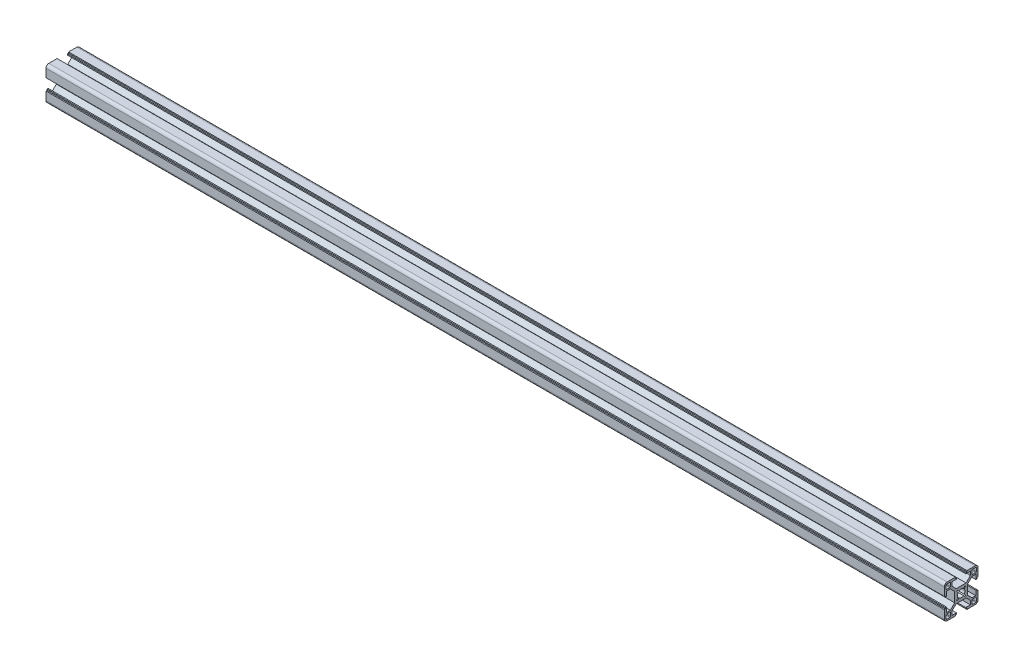
from build123d import *

# Parameters (mm, degrees)
EXTRUDE_1_DEPTH     = 50
EXTRUDE_2_DEPTH     = 800
CUT_EXTRUDE_START   = 15.049571
SKETCH_3_R          = 3
CUT_EXTRUDE_1_DEPTH = 30
CUT_EXTRUDE_START_2 = -14.950429
SKETCH_4_R          = 3
CUT_EXTRUDE_2_DEPTH = 30


with BuildPart() as part:
    # 草图1 → 凸台-拉伸1 (new body)
    with BuildSketch(Plane(origin=(0, 0, 0), x_dir=(0, 0, -1), z_dir=(1, 0, 0))):
        with BuildLine():
            Line((-5.14957074, -13.70467014), (-4.14957074, -13.70467014))
            Line((-4.14957074, -13.70467014), (-4.14957074, -12.70467014))
            Line((-4.14957074, -12.70467014), (-8.29957074, -12.70467014))
            Line((-8.29957074, -12.70467014), (-8.29957074, -9.3688837))
            Line((-8.29957074, -9.3688837), (-4.43535718, -5.50467014))
            Line((-4.43535718, -5.50467014), (4.3362157, -5.50467014))
            Line((4.3362157, -5.50467014), (8.20042926, -9.3688837))
            Line((8.20042926, -9.3688837), (8.20042926, -12.70467014))
            Line((8.20042926, -12.70467014), (4.05042926, -12.70467014))
            Line((4.05042926, -12.70467014), (4.05042926, -13.70467014))
            Line((4.05042926, -13.70467014), (5.05042926, -13.70467014))
            Line((5.05042926, -13.70467014), (5.05042926, -14.70467014))
            Line((5.05042926, -14.70467014), (12.45042926, -14.70467014))
            ThreePointArc((12.45042926, -14.70467014), (14.218196213, -13.972437093), (14.95042926, -12.20467014))
            Line((14.95042926, -12.20467014), (14.95042926, -4.80467014))
            Line((14.95042926, -4.80467014), (13.95042926, -4.80467014))
            Line((13.95042926, -4.80467014), (13.95042926, -3.80467014))
            Line((13.95042926, -3.80467014), (12.95042926, -3.80467014))
            Line((12.95042926, -3.80467014), (12.95042926, -7.95467014))
            Line((12.95042926, -7.95467014), (9.61464282, -7.95467014))
            Line((9.61464282, -7.95467014), (5.75042926, -4.09045658))
            Line((5.75042926, -4.09045658), (5.75042926, 4.6811163))
            Line((5.75042926, 4.6811163), (9.61464282, 8.54532986))
            Line((9.61464282, 8.54532986), (12.95042926, 8.54532986))
            Line((12.95042926, 8.54532986), (12.95042926, 4.39532986))
            Line((12.95042926, 4.39532986), (13.95042926, 4.39532986))
            Line((13.95042926, 4.39532986), (13.95042926, 5.39532986))
            Line((13.95042926, 5.39532986), (14.95042926, 5.39532986))
            Line((14.95042926, 5.39532986), (14.95042926, 12.79532986))
            ThreePointArc((14.95042926, 12.79532986), (14.218196213, 14.563096813), (12.45042926, 15.29532986))
            Line((12.45042926, 15.29532986), (5.05042926, 15.29532986))
            Line((5.05042926, 15.29532986), (5.05042926, 14.29532986))
            Line((5.05042926, 14.29532986), (4.05042926, 14.29532986))
            Line((4.05042926, 14.29532986), (4.05042926, 13.29532986))
            Line((4.05042926, 13.29532986), (8.20042926, 13.29532986))
            Line((8.20042926, 13.29532986), (8.20042926, 9.95954342))
            Line((8.20042926, 9.95954342), (4.3362157, 6.09532986))
            Line((4.3362157, 6.09532986), (-4.43535718, 6.09532986))
            Line((-4.43535718, 6.09532986), (-8.29957074, 9.95954342))
            Line((-8.29957074, 9.95954342), (-8.29957074, 13.29532986))
            Line((-8.29957074, 13.29532986), (-4.14957074, 13.29532986))
            Line((-4.14957074, 13.29532986), (-4.14957074, 14.29532986))
            Line((-4.14957074, 14.29532986), (-5.14957074, 14.29532986))
            Line((-5.14957074, 14.29532986), (-5.14957074, 15.29532986))
            Line((-5.14957074, 15.29532986), (-12.54957074, 15.29532986))
            ThreePointArc((-12.54957074, 15.29532986), (-14.317337693, 14.563096813), (-15.04957074, 12.79532986))
            Line((-15.04957074, 12.79532986), (-15.04957074, 5.39532986))
            Line((-15.04957074, 5.39532986), (-14.04957074, 5.39532986))
            Line((-14.04957074, 5.39532986), (-14.04957074, 4.39532986))
            Line((-14.04957074, 4.39532986), (-13.04957074, 4.39532986))
            Line((-13.04957074, 4.39532986), (-13.04957074, 8.54532986))
            Line((-13.04957074, 8.54532986), (-9.7137843, 8.54532986))
            Line((-9.7137843, 8.54532986), (-5.84957074, 4.6811163))
            Line((-5.84957074, 4.6811163), (-5.84957074, -4.09045658))
            Line((-5.84957074, -4.09045658), (-9.7137843, -7.95467014))
            Line((-9.7137843, -7.95467014), (-13.04957074, -7.95467014))
            Line((-13.04957074, -7.95467014), (-13.04957074, -3.80467014))
            Line((-13.04957074, -3.80467014), (-14.04957074, -3.80467014))
            Line((-14.04957074, -3.80467014), (-14.04957074, -4.80467014))
            Line((-14.04957074, -4.80467014), (-15.04957074, -4.80467014))
            Line((-15.04957074, -4.80467014), (-15.04957074, -12.20467014))
            ThreePointArc((-15.04957074, -12.20467014), (-14.317337693, -13.972437093), (-12.54957074, -14.70467014))
            Line((-12.54957074, -14.70467014), (-5.14957074, -14.70467014))
            Line((-5.14957074, -14.70467014), (-5.14957074, -13.70467014))
        make_face()
        with BuildLine():
            Line((-10.04957074, 9.79532986), (-13.04957074, 9.79532986))
            ThreePointArc((-13.04957074, 9.79532986), (-13.403124131, 9.941776469), (-13.54957074, 10.29532986))
            Line((-13.54957074, 10.29532986), (-13.54957074, 13.29532986))
            ThreePointArc((-13.54957074, 13.29532986), (-13.403124131, 13.648883251), (-13.04957074, 13.79532986))
            Line((-13.04957074, 13.79532986), (-10.04957074, 13.79532986))
            ThreePointArc((-10.04957074, 13.79532986), (-9.696017349, 13.648883251), (-9.54957074, 13.29532986))
            Line((-9.54957074, 13.29532986), (-9.54957074, 10.29532986))
            ThreePointArc((-9.54957074, 10.29532986), (-9.696017349, 9.941776469), (-10.04957074, 9.79532986))
        make_face(mode=Mode.SUBTRACT)
        with BuildLine():
            Line((-10.04957074, -13.20467014), (-13.04957074, -13.20467014))
            ThreePointArc((-13.04957074, -13.20467014), (-13.403124131, -13.058223531), (-13.54957074, -12.70467014))
            Line((-13.54957074, -12.70467014), (-13.54957074, -9.70467014))
            ThreePointArc((-13.54957074, -9.70467014), (-13.403124131, -9.351116749), (-13.04957074, -9.20467014))
            Line((-13.04957074, -9.20467014), (-10.04957074, -9.20467014))
            ThreePointArc((-10.04957074, -9.20467014), (-9.696017349, -9.351116749), (-9.54957074, -9.70467014))
            Line((-9.54957074, -9.70467014), (-9.54957074, -12.70467014))
            ThreePointArc((-9.54957074, -12.70467014), (-9.696017349, -13.058223531), (-10.04957074, -13.20467014))
        make_face(mode=Mode.SUBTRACT)
        with BuildLine():
            Line((12.95042926, 9.79532986), (9.95042926, 9.79532986))
            ThreePointArc((9.95042926, 9.79532986), (9.596875869, 9.941776469), (9.45042926, 10.29532986))
            Line((9.45042926, 10.29532986), (9.45042926, 13.29532986))
            ThreePointArc((9.45042926, 13.29532986), (9.596875869, 13.648883251), (9.95042926, 13.79532986))
            Line((9.95042926, 13.79532986), (12.95042926, 13.79532986))
            ThreePointArc((12.95042926, 13.79532986), (13.303982651, 13.648883251), (13.45042926, 13.29532986))
            Line((13.45042926, 13.29532986), (13.45042926, 10.29532986))
            ThreePointArc((13.45042926, 10.29532986), (13.303982651, 9.941776469), (12.95042926, 9.79532986))
        make_face(mode=Mode.SUBTRACT)
        with BuildLine():
            Line((13.45042926, -9.70467014), (13.45042926, -12.70467014))
            ThreePointArc((13.45042926, -12.70467014), (13.303982651, -13.058223531), (12.95042926, -13.20467014))
            Line((12.95042926, -13.20467014), (9.95042926, -13.20467014))
            ThreePointArc((9.95042926, -13.20467014), (9.596875869, -13.058223531), (9.45042926, -12.70467014))
            Line((9.45042926, -12.70467014), (9.45042926, -9.70467014))
            ThreePointArc((9.45042926, -9.70467014), (9.596875869, -9.351116749), (9.95042926, -9.20467014))
            Line((9.95042926, -9.20467014), (12.95042926, -9.20467014))
            ThreePointArc((12.95042926, -9.20467014), (13.303982651, -9.351116749), (13.45042926, -9.70467014))
        make_face(mode=Mode.SUBTRACT)
        with BuildLine():
            Line((-4.07998961, 3.61864195), (-3.37288283, 4.32574873))
            Line((-3.37288283, 4.32574873), (-2.07404174, 3.02690764))
            ThreePointArc((-2.07404174, 3.02690764), (-0.04957074, 3.69532986), (1.97490026, 3.02690764))
            Line((1.97490026, 3.02690764), (3.27374135, 4.32574873))
            Line((3.27374135, 4.32574873), (3.98084813, 3.61864195))
            Line((3.98084813, 3.61864195), (2.68200704, 2.31980086))
            ThreePointArc((2.68200704, 2.31980086), (3.35042926, 0.29532986), (2.68200704, -1.72914114))
            Line((2.68200704, -1.72914114), (3.98084813, -3.02798223))
            Line((3.98084813, -3.02798223), (3.27374135, -3.73508901))
            Line((3.27374135, -3.73508901), (1.97490026, -2.43624792))
            ThreePointArc((1.97490026, -2.43624792), (-0.04957074, -3.10467014), (-2.07404174, -2.43624792))
            Line((-2.07404174, -2.43624792), (-3.37288283, -3.73508901))
            Line((-3.37288283, -3.73508901), (-4.07998961, -3.02798223))
            Line((-4.07998961, -3.02798223), (-2.78114852, -1.72914114))
            ThreePointArc((-2.78114852, -1.72914114), (-3.44957074, 0.29532986), (-2.78114852, 2.31980086))
            Line((-2.78114852, 2.31980086), (-4.07998961, 3.61864195))
        make_face(mode=Mode.SUBTRACT)
    extrude(amount=-EXTRUDE_1_DEPTH)

    # 草图2 → 凸台-拉伸2 (add)
    with BuildSketch(Plane(origin=(0, 0, 0), x_dir=(0, 0, -1), z_dir=(1, 0, 0))):
        with BuildLine():
            Line((-15.04957074, -4.80467014), (-15.04957074, -12.20467014))
            ThreePointArc((-15.04957074, -12.20467014), (-14.317337693, -13.972437093), (-12.54957074, -14.70467014))
            Line((-12.54957074, -14.70467014), (-5.14957074, -14.70467014))
            Line((-5.14957074, -14.70467014), (-5.14957074, -13.70467014))
            Line((-5.14957074, -13.70467014), (-4.14957074, -13.70467014))
            Line((-4.14957074, -13.70467014), (-4.14957074, -12.70467014))
            Line((-4.14957074, -12.70467014), (-8.29957074, -12.70467014))
            Line((-8.29957074, -12.70467014), (-8.29957074, -9.3688837))
            Line((-8.29957074, -9.3688837), (-4.43535718, -5.50467014))
            Line((-4.43535718, -5.50467014), (4.3362157, -5.50467014))
            Line((4.3362157, -5.50467014), (8.20042926, -9.3688837))
            Line((8.20042926, -9.3688837), (8.20042926, -12.70467014))
            Line((8.20042926, -12.70467014), (4.05042926, -12.70467014))
            Line((4.05042926, -12.70467014), (4.05042926, -13.70467014))
            Line((4.05042926, -13.70467014), (5.05042926, -13.70467014))
            Line((5.05042926, -13.70467014), (5.05042926, -14.70467014))
            Line((5.05042926, -14.70467014), (12.45042926, -14.70467014))
            ThreePointArc((12.45042926, -14.70467014), (14.218196213, -13.972437093), (14.95042926, -12.20467014))
            Line((14.95042926, -12.20467014), (14.95042926, -4.80467014))
            Line((14.95042926, -4.80467014), (13.95042926, -4.80467014))
            Line((13.95042926, -4.80467014), (13.95042926, -3.80467014))
            Line((13.95042926, -3.80467014), (12.95042926, -3.80467014))
            Line((12.95042926, -3.80467014), (12.95042926, -7.95467014))
            Line((12.95042926, -7.95467014), (9.61464282, -7.95467014))
            Line((9.61464282, -7.95467014), (5.75042926, -4.09045658))
            Line((5.75042926, -4.09045658), (5.75042926, 4.6811163))
            Line((5.75042926, 4.6811163), (9.61464282, 8.54532986))
            Line((9.61464282, 8.54532986), (12.95042926, 8.54532986))
            Line((12.95042926, 8.54532986), (12.95042926, 4.39532986))
            Line((12.95042926, 4.39532986), (13.95042926, 4.39532986))
            Line((13.95042926, 4.39532986), (13.95042926, 5.39532986))
            Line((13.95042926, 5.39532986), (14.95042926, 5.39532986))
            Line((14.95042926, 5.39532986), (14.95042926, 12.79532986))
            ThreePointArc((14.95042926, 12.79532986), (14.218196213, 14.563096813), (12.45042926, 15.29532986))
            Line((12.45042926, 15.29532986), (5.05042926, 15.29532986))
            Line((5.05042926, 15.29532986), (5.05042926, 14.29532986))
            Line((5.05042926, 14.29532986), (4.05042926, 14.29532986))
            Line((4.05042926, 14.29532986), (4.05042926, 13.29532986))
            Line((4.05042926, 13.29532986), (8.20042926, 13.29532986))
            Line((8.20042926, 13.29532986), (8.20042926, 9.95954342))
            Line((8.20042926, 9.95954342), (4.3362157, 6.09532986))
            Line((4.3362157, 6.09532986), (-4.43535718, 6.09532986))
            Line((-4.43535718, 6.09532986), (-8.29957074, 9.95954342))
            Line((-8.29957074, 9.95954342), (-8.29957074, 13.29532986))
            Line((-8.29957074, 13.29532986), (-4.14957074, 13.29532986))
            Line((-4.14957074, 13.29532986), (-4.14957074, 14.29532986))
            Line((-4.14957074, 14.29532986), (-5.14957074, 14.29532986))
            Line((-5.14957074, 14.29532986), (-5.14957074, 15.29532986))
            Line((-5.14957074, 15.29532986), (-12.54957074, 15.29532986))
            ThreePointArc((-12.54957074, 15.29532986), (-14.317337693, 14.563096813), (-15.04957074, 12.79532986))
            Line((-15.04957074, 12.79532986), (-15.04957074, 5.39532986))
            Line((-15.04957074, 5.39532986), (-14.04957074, 5.39532986))
            Line((-14.04957074, 5.39532986), (-14.04957074, 4.39532986))
            Line((-14.04957074, 4.39532986), (-13.04957074, 4.39532986))
            Line((-13.04957074, 4.39532986), (-13.04957074, 8.54532986))
            Line((-13.04957074, 8.54532986), (-9.7137843, 8.54532986))
            Line((-9.7137843, 8.54532986), (-5.84957074, 4.6811163))
            Line((-5.84957074, 4.6811163), (-5.84957074, -4.09045658))
            Line((-5.84957074, -4.09045658), (-9.7137843, -7.95467014))
            Line((-9.7137843, -7.95467014), (-13.04957074, -7.95467014))
            Line((-13.04957074, -7.95467014), (-13.04957074, -3.80467014))
            Line((-13.04957074, -3.80467014), (-14.04957074, -3.80467014))
            Line((-14.04957074, -3.80467014), (-14.04957074, -4.80467014))
            Line((-14.04957074, -4.80467014), (-15.04957074, -4.80467014))
        make_face()
        with BuildLine():
            Line((-13.04957074, 9.79532986), (-10.04957074, 9.79532986))
            ThreePointArc((-10.04957074, 9.79532986), (-9.696017349, 9.941776469), (-9.54957074, 10.29532986))
            Line((-9.54957074, 10.29532986), (-9.54957074, 13.29532986))
            ThreePointArc((-9.54957074, 13.29532986), (-9.696017349, 13.648883251), (-10.04957074, 13.79532986))
            Line((-10.04957074, 13.79532986), (-13.04957074, 13.79532986))
            ThreePointArc((-13.04957074, 13.79532986), (-13.403124131, 13.648883251), (-13.54957074, 13.29532986))
            Line((-13.54957074, 13.29532986), (-13.54957074, 10.29532986))
            ThreePointArc((-13.54957074, 10.29532986), (-13.403124131, 9.941776469), (-13.04957074, 9.79532986))
        make_face(mode=Mode.SUBTRACT)
        with BuildLine():
            Line((-13.04957074, -13.20467014), (-10.04957074, -13.20467014))
            ThreePointArc((-10.04957074, -13.20467014), (-9.696017349, -13.058223531), (-9.54957074, -12.70467014))
            Line((-9.54957074, -12.70467014), (-9.54957074, -9.70467014))
            ThreePointArc((-9.54957074, -9.70467014), (-9.696017349, -9.351116749), (-10.04957074, -9.20467014))
            Line((-10.04957074, -9.20467014), (-13.04957074, -9.20467014))
            ThreePointArc((-13.04957074, -9.20467014), (-13.403124131, -9.351116749), (-13.54957074, -9.70467014))
            Line((-13.54957074, -9.70467014), (-13.54957074, -12.70467014))
            ThreePointArc((-13.54957074, -12.70467014), (-13.403124131, -13.058223531), (-13.04957074, -13.20467014))
        make_face(mode=Mode.SUBTRACT)
        with BuildLine():
            Line((9.45042926, 13.29532986), (9.45042926, 10.29532986))
            ThreePointArc((9.45042926, 10.29532986), (9.596875869, 9.941776469), (9.95042926, 9.79532986))
            Line((9.95042926, 9.79532986), (12.95042926, 9.79532986))
            ThreePointArc((12.95042926, 9.79532986), (13.303982651, 9.941776469), (13.45042926, 10.29532986))
            Line((13.45042926, 10.29532986), (13.45042926, 13.29532986))
            ThreePointArc((13.45042926, 13.29532986), (13.303982651, 13.648883251), (12.95042926, 13.79532986))
            Line((12.95042926, 13.79532986), (9.95042926, 13.79532986))
            ThreePointArc((9.95042926, 13.79532986), (9.596875869, 13.648883251), (9.45042926, 13.29532986))
        make_face(mode=Mode.SUBTRACT)
        with BuildLine():
            Line((9.45042926, -9.70467014), (9.45042926, -12.70467014))
            ThreePointArc((9.45042926, -12.70467014), (9.596875869, -13.058223531), (9.95042926, -13.20467014))
            Line((9.95042926, -13.20467014), (12.95042926, -13.20467014))
            ThreePointArc((12.95042926, -13.20467014), (13.303982651, -13.058223531), (13.45042926, -12.70467014))
            Line((13.45042926, -12.70467014), (13.45042926, -9.70467014))
            ThreePointArc((13.45042926, -9.70467014), (13.303982651, -9.351116749), (12.95042926, -9.20467014))
            Line((12.95042926, -9.20467014), (9.95042926, -9.20467014))
            ThreePointArc((9.95042926, -9.20467014), (9.596875869, -9.351116749), (9.45042926, -9.70467014))
        make_face(mode=Mode.SUBTRACT)
        with BuildLine():
            Line((-3.37288283, -3.73508901), (-2.07404174, -2.43624792))
            ThreePointArc((-2.07404174, -2.43624792), (-0.04957074, -3.10467014), (1.97490026, -2.43624792))
            Line((1.97490026, -2.43624792), (3.27374135, -3.73508901))
            Line((3.27374135, -3.73508901), (3.98084813, -3.02798223))
            Line((3.98084813, -3.02798223), (2.68200704, -1.72914114))
            ThreePointArc((2.68200704, -1.72914114), (3.35042926, 0.29532986), (2.68200704, 2.31980086))
            Line((2.68200704, 2.31980086), (3.98084813, 3.61864195))
            Line((3.98084813, 3.61864195), (3.27374135, 4.32574873))
            Line((3.27374135, 4.32574873), (1.97490026, 3.02690764))
            ThreePointArc((1.97490026, 3.02690764), (-0.04957074, 3.69532986), (-2.07404174, 3.02690764))
            Line((-2.07404174, 3.02690764), (-3.37288283, 4.32574873))
            Line((-3.37288283, 4.32574873), (-4.07998961, 3.61864195))
            Line((-4.07998961, 3.61864195), (-2.78114852, 2.31980086))
            ThreePointArc((-2.78114852, 2.31980086), (-3.44957074, 0.29532986), (-2.78114852, -1.72914114))
            Line((-2.78114852, -1.72914114), (-4.07998961, -3.02798223))
            Line((-4.07998961, -3.02798223), (-3.37288283, -3.73508901))
        make_face(mode=Mode.SUBTRACT)
    extrude(amount=-EXTRUDE_2_DEPTH)

    # 草图3 → 切除-拉伸1 (cut)
    with BuildSketch(Plane.XY.offset(CUT_EXTRUDE_START)):
        with Locations(Location((-755, 0, 0), (0, 0, 324.803641529))):
            Circle(SKETCH_3_R)
        with Locations(Location((-45, 0, 0), (0, 0, 324.803641529))):
            Circle(SKETCH_3_R)
    extrude(amount=-CUT_EXTRUDE_1_DEPTH, mode=Mode.SUBTRACT)

    # 草图4 → 切除-拉伸2 (cut)
    with BuildSketch(Plane.XY.offset(CUT_EXTRUDE_START_2)):
        with Locations(Location((-501.8, 0, 0), (0, 0, 215.196289329))):
            Circle(SKETCH_4_R)
        with Locations(Location((-448.2, 0, 0), (0, 0, 215.196289329))):
            Circle(SKETCH_4_R)
        with Locations(Location((-351.8, 0, 0), (0, 0, 215.196289329))):
            Circle(SKETCH_4_R)
        with Locations(Location((-298.2, 0, 0), (0, 0, 215.196289329))):
            Circle(SKETCH_4_R)
    extrude(amount=CUT_EXTRUDE_2_DEPTH, mode=Mode.SUBTRACT)


solid = part.part
